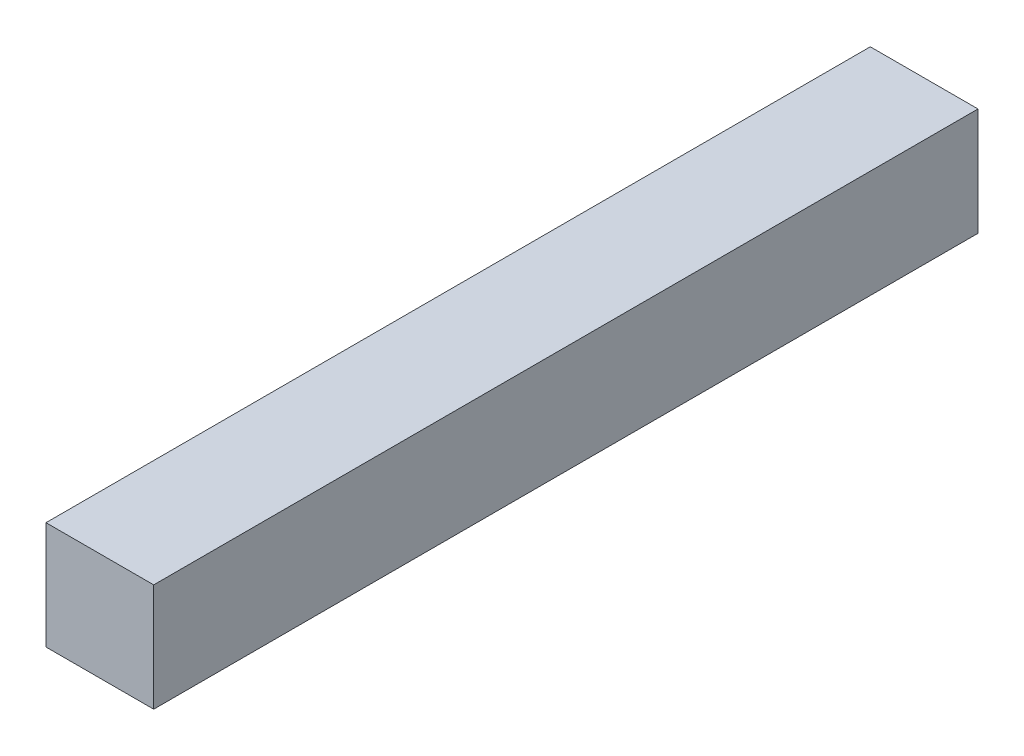
from build123d import *

# Parameters (mm, degrees)
SKETCH1_W           = 40
SKETCH1_H           = 306.131694859
BOSS_EXTRUDE1_DEPTH = 40


with BuildPart() as part:
    # Sketch1 → Boss-Extrude1 (new body)
    with BuildSketch(Plane(origin=(0, 0, 0), x_dir=(1, 0, 0), z_dir=(0, 1, 0))):
        with Locations((-20, -153.065847429)):
            Rectangle(SKETCH1_W, SKETCH1_H)
    extrude(amount=BOSS_EXTRUDE1_DEPTH)


solid = part.part
